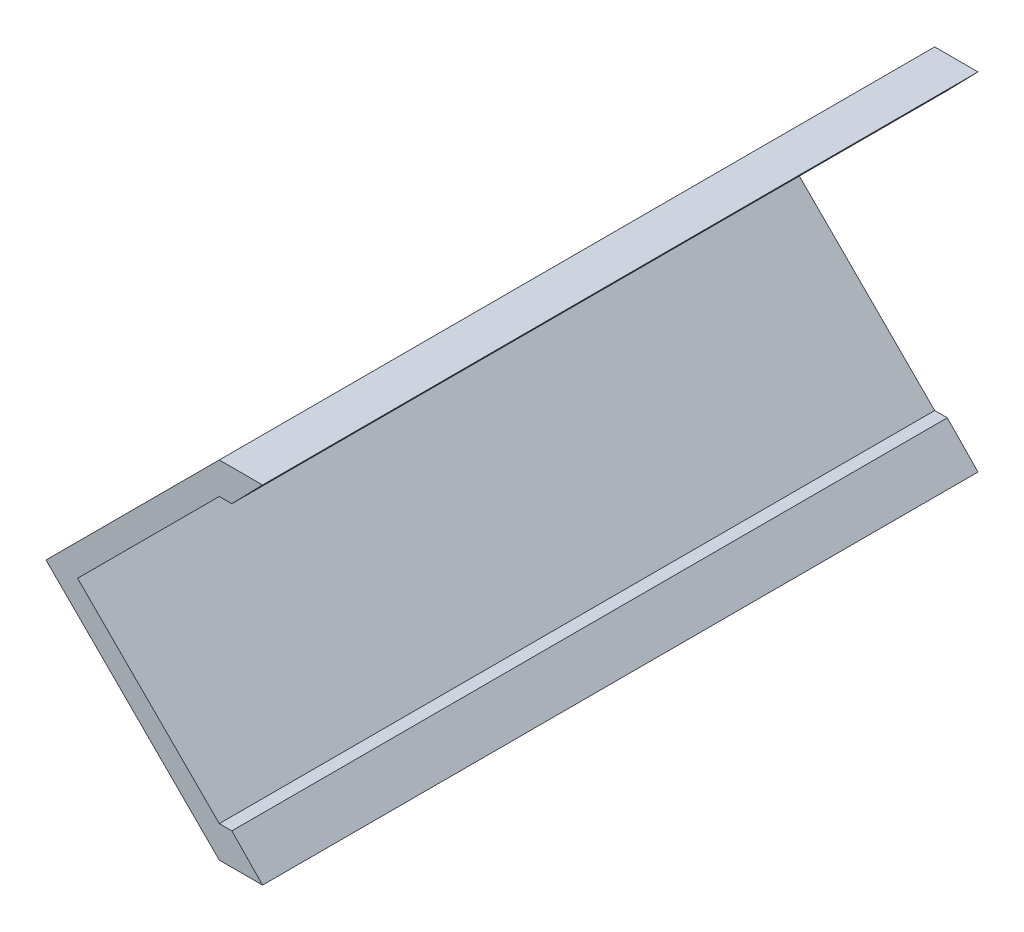
from build123d import *

# Parameters (mm, degrees)
V_DEFLECTOR_DEPTH = 51.2


with BuildPart() as part:
    # Sketch1 → V_deflector (new body)
    with BuildSketch(Plane.XY):
        Polygon((22, 0), (34.4, -12.4), (37.497500298, -12.4), (35.299665589, -10.1372583), (34.4, -10.1372583), (24.2627417, 0), (34.4, 10.1372583), (35.299665589, 10.1372583), (37.497500298, 12.4), (34.4, 12.4), align=None)
    extrude(amount=V_DEFLECTOR_DEPTH)


solid = part.part
